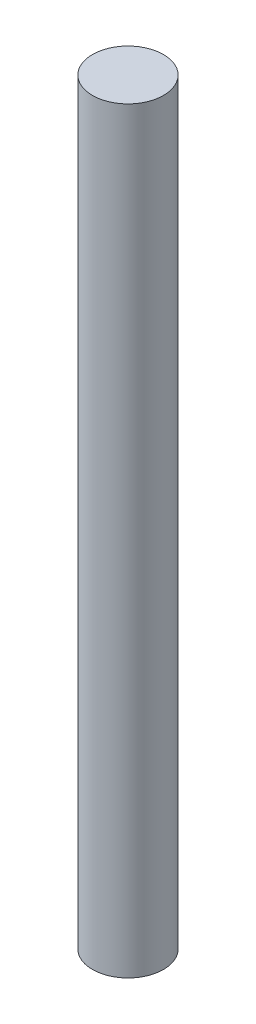
from build123d import *

# Parameters (mm, degrees)
SKETCH_1_R      = 1.5
EXTRUDE_1_DEPTH = 32


with BuildPart() as part:
    # ｽｹｯﾁ1 → ﾎﾞｽ - 押し出し1 (new body)
    with BuildSketch(Plane(origin=(0, 0, 0), x_dir=(1, 0, 0), z_dir=(0, 1, 0))):
        with Locations(Location((0, 0, 0), (0, 0, 270))):
            Circle(SKETCH_1_R)
    extrude(amount=EXTRUDE_1_DEPTH)


solid = part.part
